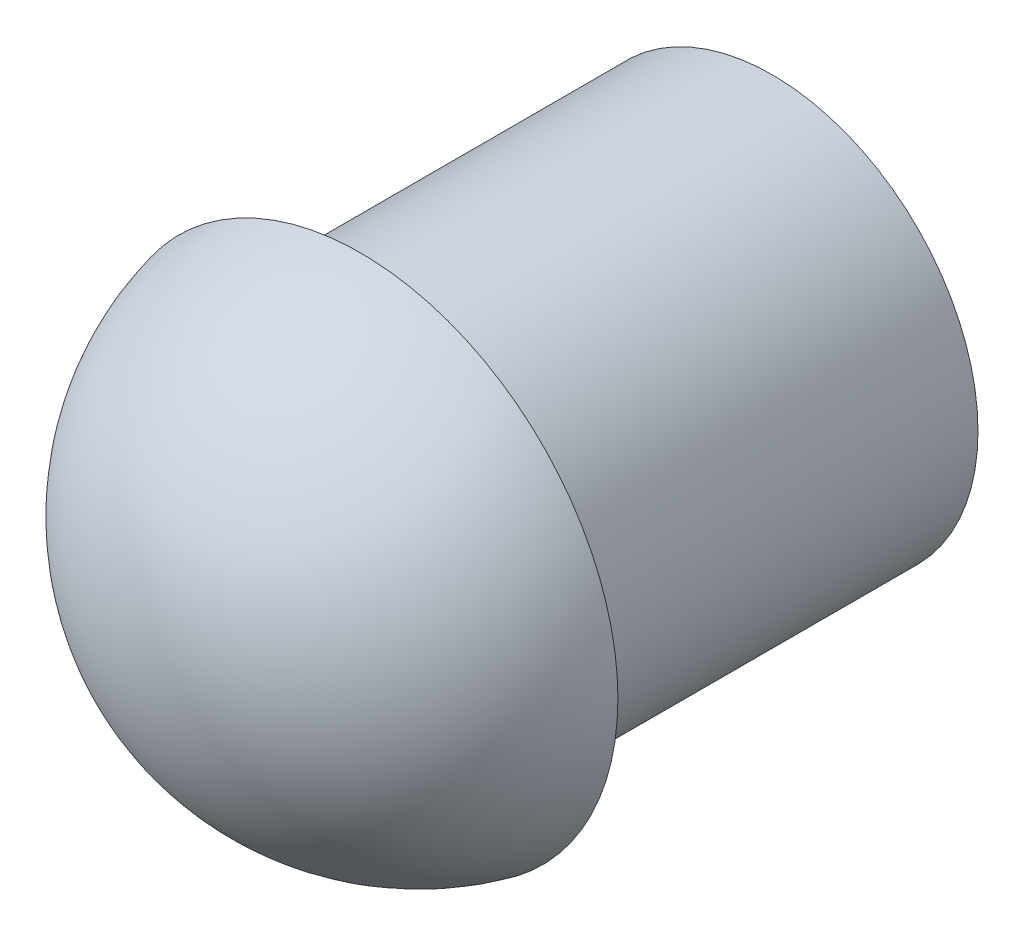
from build123d import *

# Parameters (mm, degrees)
SKETCH1_R           = 20
BOSS_EXTRUDE1_DEPTH = 40
SKETCH2_R           = 25
BOSS_EXTRUDE2_DEPTH = 20


with BuildPart() as part:
    # Sketch1 → Boss-Extrude1 (new body)
    with BuildSketch(Plane.XY):
        Circle(SKETCH1_R)
    extrude(amount=BOSS_EXTRUDE1_DEPTH)

    # Sketch2 → Boss-Extrude2 (add)
    with BuildSketch(Plane.XY.offset(40)):
        Circle(SKETCH2_R)
    extrude(amount=BOSS_EXTRUDE2_DEPTH)

    # Sketch4 → Cut-Revolve5 (revolve, cut)
    with BuildSketch(Plane(origin=(0, 0, 0), x_dir=(1, 0, 0), z_dir=(0, 1, 0))):
        with BuildLine():
            Line((25, -40), (27.091605725, -40))
            Line((27.091605725, -40), (27.091605725, -68.789688177))
            Line((27.091605725, -68.789688177), (0, -68.789688177))
            Line((0, -68.789688177), (0, -60))
            ThreePointArc((0, -60), (16.000238689, -54.375298361), (25, -40))
        make_face()
    revolve(axis=Axis((0, 0, -11.257666391), (0, 0, 1)), mode=Mode.SUBTRACT)


solid = part.part
